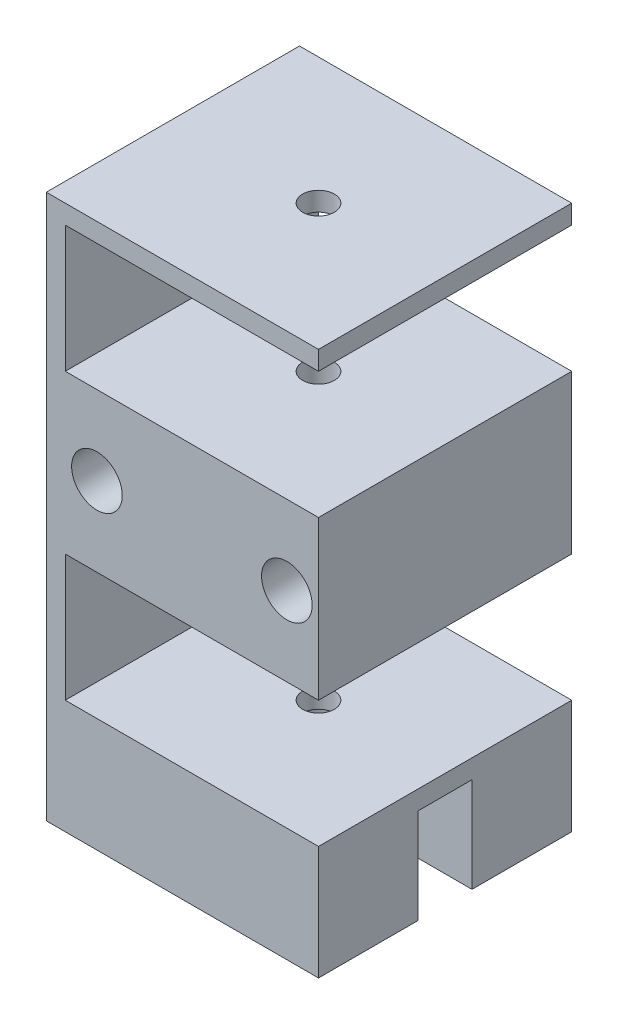
from build123d import *

# Parameters (mm, degrees)
SKETCH1_R               = 4
BOSS_EXTRUDE1_DEPTH     = 40
CUT_EXTRUDE1_DEPTH      = 76.848533275
CUT_EXTRUDE1_DEPTH_BACK = 76.848533275
SKETCH3_R               = 2.5
CUT_EXTRUDE2_DEPTH      = 15


with BuildPart() as part:
    # Sketch1 → Boss-Extrude1 (new body)
    with BuildSketch(Plane.XY):
        Polygon((0, 0), (-40, 0), (-40, 20), (0, 20), (0, 45), (-40, 45), (-40, 65), (0, 65), (0, 68), (-43, 68), (-43, 65), (-43, 45), (-43, -18), (0, -18), align=None)
        with Locations((-35, 32.5)):
            Circle(SKETCH1_R, mode=Mode.SUBTRACT)
        with Locations((-5, 32.5)):
            Circle(SKETCH1_R, mode=Mode.SUBTRACT)
    extrude(amount=BOSS_EXTRUDE1_DEPTH)

    # Sketch3 → Cut-Extrude1 (cut, two sides: drawn at the far end of the back side and taken through both)
    with BuildSketch(Plane(origin=(0, 20, 0), x_dir=(-1, 0, 0), z_dir=(0, -1, 0)).offset(-CUT_EXTRUDE1_DEPTH_BACK)):
        with Locations(Location((20, -20, 0), (0, 0, 180))):
            Circle(SKETCH3_R)
    extrude(amount=CUT_EXTRUDE1_DEPTH + CUT_EXTRUDE1_DEPTH_BACK, mode=Mode.SUBTRACT)

    # Sketch4 → Cut-Extrude2 (cut)
    with BuildSketch(Plane(origin=(0, -18, 0), x_dir=(-1, 0, 0), z_dir=(0, -1, 0))):
        with BuildLine():
            Line((20, -24.25), (0, -24.25))
            Line((0, -24.25), (0, -15.75))
            Line((0, -15.75), (20, -15.75))
            ThreePointArc((20, -15.75), (24.25, -20), (20, -24.25))
        make_face()
    extrude(amount=-CUT_EXTRUDE2_DEPTH, mode=Mode.SUBTRACT)


solid = part.part
